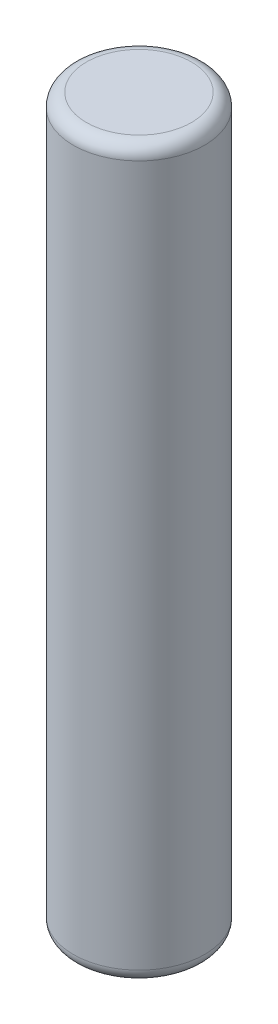
from build123d import *

# Parameters (mm, degrees)
SKETCH1_R           = 2.5
BOSS_EXTRUDE1_DEPTH = 27.7
FILLET1_R           = 0.5


with BuildPart() as part:
    # Sketch1 → Boss-Extrude1 (new body)
    with BuildSketch(Plane(origin=(0, 0, 0), x_dir=(1, 0, 0), z_dir=(0, 1, 0))):
        with Locations(Location((0, 0, 0), (0, 0, 270))):
            Circle(SKETCH1_R)
    extrude(amount=BOSS_EXTRUDE1_DEPTH)

    # Fillet1
    fillet1_edges = [part.edges().sort_by_distance(p)[0] for p in [
        (0, 0, -2.5),
        (0, 27.7, -2.5),
    ]]
    fillet(fillet1_edges, radius=FILLET1_R)


solid = part.part
